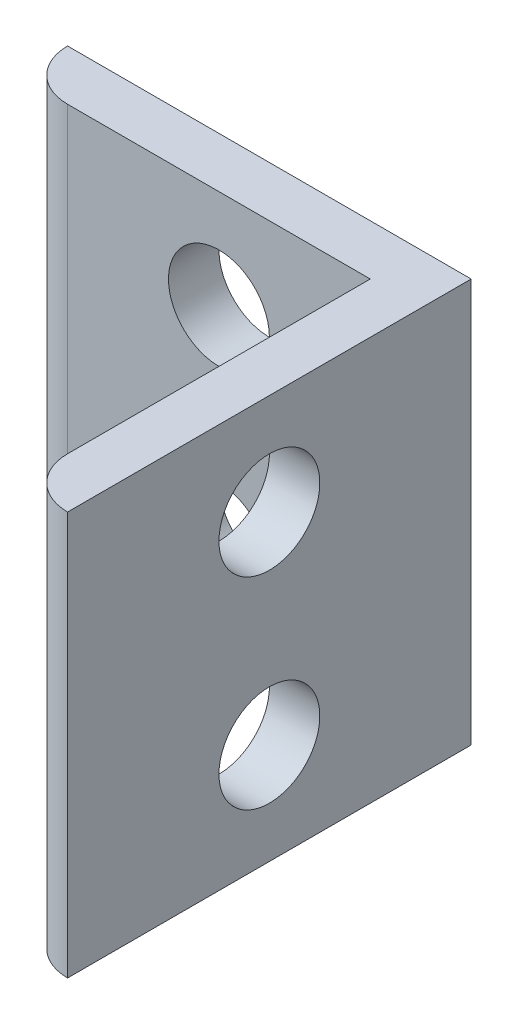
from build123d import *

# Parameters (mm, degrees)
BOSS_EXTRUDE1_DEPTH         = 25.4
F_1_4_0_25_DIAMETER_HOLE1_D = 6.35
F_1_4_0_25_DIAMETER_HOLE2_D = 6.35


with BuildPart() as part:
    # Sketch1 → Boss-Extrude1 (new body)
    with BuildSketch(Plane(origin=(0, 0, 0), x_dir=(1, 0, 0), z_dir=(0, 1, 0))):
        with BuildLine():
            Line((0, 0), (25.4, 0))
            Line((25.4, 0), (25.4, -25.4))
            ThreePointArc((25.4, -25.4), (23.15493597, -24.47006403), (22.225, -22.225))
            Line((22.225, -22.225), (22.225, -3.175))
            Line((22.225, -3.175), (3.175, -3.175))
            ThreePointArc((3.175, -3.175), (0.92993597, -2.24506403), (0, 0))
        make_face()
    extrude(amount=BOSS_EXTRUDE1_DEPTH)

    # 1/4 (0.25) Diameter Hole1 (through all)
    with Locations(Plane.ZY.offset(-22.225)):
        with Locations((12.7, 19.05), (12.7, 6.35)):
            Hole(F_1_4_0_25_DIAMETER_HOLE1_D / 2)

    # 1/4 (0.25) Diameter Hole2 (through all)
    with Locations(Plane.XY.offset(3.175)):
        with Locations((12.7, 19.05), (12.7, 6.35)):
            Hole(F_1_4_0_25_DIAMETER_HOLE2_D / 2)


solid = part.part
